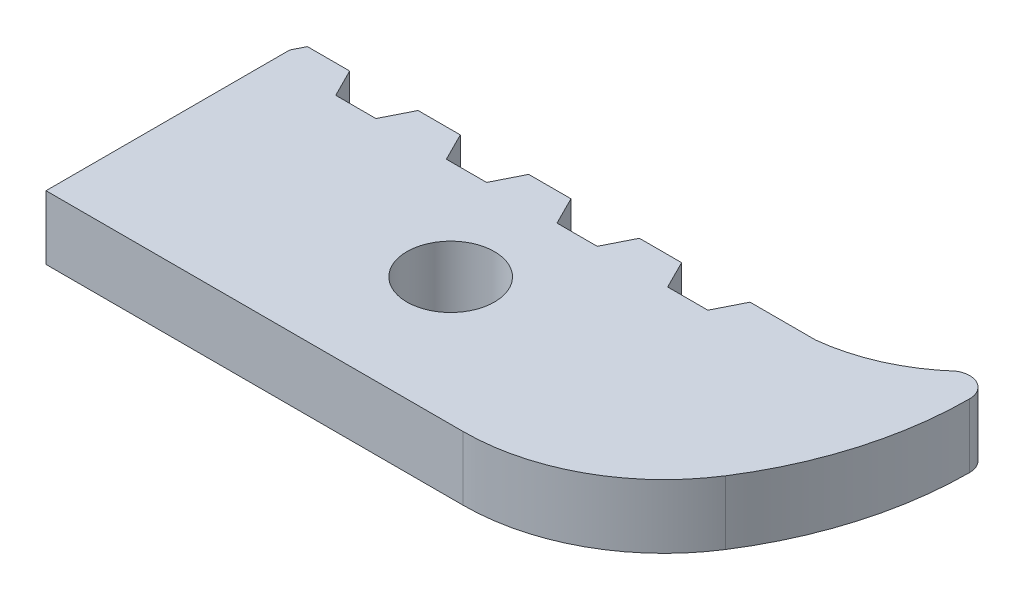
from build123d import *

# Parameters (mm, degrees)
BOSS_EXTRUDE1_DEPTH = 3.175
SKETCH2_R           = 2.175
CUT_EXTRUDE2_DEPTH  = 6.35
BOSS_EXTRUDE2_DEPTH = 3.175
CUT_EXTRUDE3_DEPTH  = 10
FILLET1_R           = 10
CUT_EXTRUDE4_DEPTH  = 10
SKETCH6_W           = 56.98519
SKETCH6_H           = 25.4
CUT_EXTRUDE5_DEPTH  = 71.135360158


with BuildPart() as part:
    # Sketch1 → Boss-Extrude1 (new body)
    with BuildSketch(Plane(origin=(0, 0, 0), x_dir=(1, 0, 0), z_dir=(0, 1, 0))):
        with BuildLine():
            Line((-62.844661922, 8.700177936), (13.355338078, 8.700177936))
            ThreePointArc((13.355338078, 8.700177936), (19.705338078, 2.350177936), (13.355338078, -3.999822064))
            Line((13.355338078, -3.999822064), (-62.844661922, -3.999822064))
            ThreePointArc((-62.844661922, -3.999822064), (-69.194661922, 2.350177936), (-62.844661922, 8.700177936))
        make_face()
    extrude(amount=BOSS_EXTRUDE1_DEPTH)

    # Sketch2 → Cut-Extrude2 (cut)
    with BuildSketch(Plane(origin=(0, 3.175, 0), x_dir=(1, 0, 0), z_dir=(0, 1, 0))):
        with Locations(Location((-62.844661922, 2.350177936, 0), (0, 0, 270))):
            Circle(SKETCH2_R)
        with Locations(Location((-31.094661922, 2.350177936, 0), (0, 0, 270))):
            Circle(SKETCH2_R)
        with Locations(Location((1.555338078, 2.350177936, 0), (0, 0, 270))):
            Circle(SKETCH2_R)
    extrude(amount=-CUT_EXTRUDE2_DEPTH, mode=Mode.SUBTRACT)

    # Sketch3 → Boss-Extrude2 (add)
    with BuildSketch(Plane(origin=(0, 3.175, 0), x_dir=(1, 0, 0), z_dir=(0, 1, 0))):
        with BuildLine():
            Line((13.355338078, 8.700177936), (13.355338078, 2.350177936))
            Line((13.355338078, 2.350177936), (19.705338078, 2.350177936))
            Line((19.705338078, 2.350177936), (19.705338078, 9.999403669))
            ThreePointArc((19.705338078, 9.999403669), (19.189460997, 10.874403669), (18.174088078, 10.846618776))
            ThreePointArc((18.174088078, 10.846618776), (15.930319915, 9.401611756), (13.355338078, 8.700177936))
        make_face()
    extrude(amount=-BOSS_EXTRUDE2_DEPTH)

    # Sketch4 → Cut-Extrude3 (cut)
    with BuildSketch(Plane(origin=(0, 3.175, 0), x_dir=(1, 0, 0), z_dir=(0, 1, 0))):
        with BuildLine():
            Line((19.705338078, 9.999403669), (19.705338078, -6.000596331))
            Line((19.705338078, -6.000596331), (9.205338078, -6.000596331))
            ThreePointArc((9.205338078, -6.000596331), (16.836220051, 0.436949875), (19.705338078, 9.999403669))
        make_face()
    extrude(amount=-CUT_EXTRUDE3_DEPTH, mode=Mode.SUBTRACT)

    # Fillet1
    fillet1_edges = [part.edges().sort_by_distance(p)[0] for p in [
        (12.654174153, 1.5875, 3.999822064),
    ]]
    fillet(fillet1_edges, radius=FILLET1_R)

    # Sketch5 → Cut-Extrude4 (cut)
    with BuildSketch(Plane(origin=(0, 3.175, 0), x_dir=(1, 0, 0), z_dir=(0, 1, 0))):
        Polygon((-4.314661922, 8.700177936), (-0.914661922, 8.700177936), (-1.614661922, 7.306047383), (-3.614661922, 7.306047383), align=None)
        Polygon((-9.814661922, 8.700177936), (-9.114661922, 7.306047383), (-7.114661922, 7.306047383), (-6.414661922, 8.700177936), align=None)
        Polygon((1.185338078, 8.700177936), (4.585338078, 8.700177936), (3.885338078, 7.306047383), (1.885338078, 7.306047383), align=None)
        Polygon((6.685338078, 8.700177936), (10.085338078, 8.700177936), (9.385338078, 7.306047383), (7.385338078, 7.306047383), align=None)
        Polygon((-15.314661922, 8.700177936), (-11.914661922, 8.700177936), (-12.614661922, 7.306047383), (-14.614661922, 7.306047383), align=None)
        Polygon((-20.814661922, 8.700177936), (-17.414661922, 8.700177936), (-18.114661922, 7.306047383), (-20.114661922, 7.306047383), align=None)
        Polygon((-26.314661922, 8.700177936), (-22.914661922, 8.700177936), (-23.614661922, 7.306047383), (-25.614661922, 7.306047383), align=None)
    extrude(amount=-CUT_EXTRUDE4_DEPTH, mode=Mode.SUBTRACT)

    # Sketch6 → Cut-Extrude5 (cut, through all)
    with BuildSketch(Plane(origin=(0, 3.175, 0), x_dir=(1, 0, 0), z_dir=(0, 1, 0))):
        with Locations((-40.702066922, 2.350177936)):
            Rectangle(SKETCH6_W, SKETCH6_H)
    extrude(amount=-CUT_EXTRUDE5_DEPTH, mode=Mode.SUBTRACT)


solid = part.part
